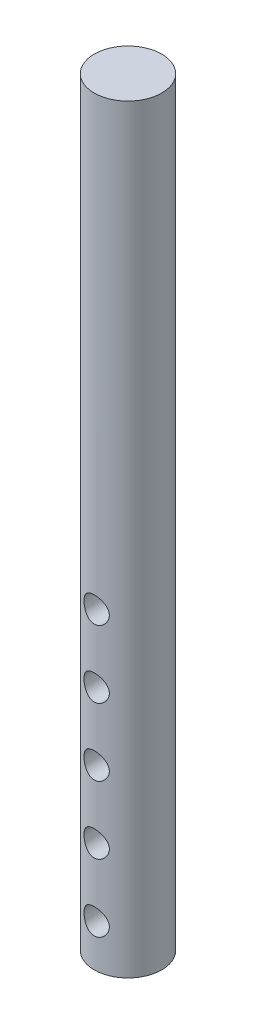
from build123d import *

# Parameters (mm, degrees)
SKETCH1_R           = 2.54
BOSS_EXTRUDE1_DEPTH = 57.15
SKETCH2_R           = 0.9525
CUT_EXTRUDE1_DEPTH  = 1.905
SCALE1_SCALE        = 1.5


with BuildPart() as part:
    # Sketch1 → Boss-Extrude1 (new body)
    with BuildSketch(Plane(origin=(0, 0, 0), x_dir=(1, 0, 0), z_dir=(0, 1, 0))):
        with Locations(Location((0, 0, 0), (0, 0, 270))):
            Circle(SKETCH1_R)
    extrude(amount=BOSS_EXTRUDE1_DEPTH)

    # Sketch2 → Cut-Extrude1 (cut)
    with BuildSketch(Plane.XY.offset(2.54)):
        with Locations((0, 18.415)):
            Circle(SKETCH2_R)
        with Locations((0, 13.335)):
            Circle(SKETCH2_R)
        with Locations((0, 8.255)):
            Circle(SKETCH2_R)
        with Locations((0, 23.495)):
            Circle(SKETCH2_R)
        with Locations((0, 3.175)):
            Circle(SKETCH2_R)
    extrude(amount=-CUT_EXTRUDE1_DEPTH, mode=Mode.SUBTRACT)


with BuildPart() as part_1:
    # Scale1: scaled about (3.3e-08, 28.93183337, -0.036650166)
    add(part.part.scale(SCALE1_SCALE).moved(Location((-1.6e-08, -14.465916685, 0.018325083))))


solid = part_1.part
